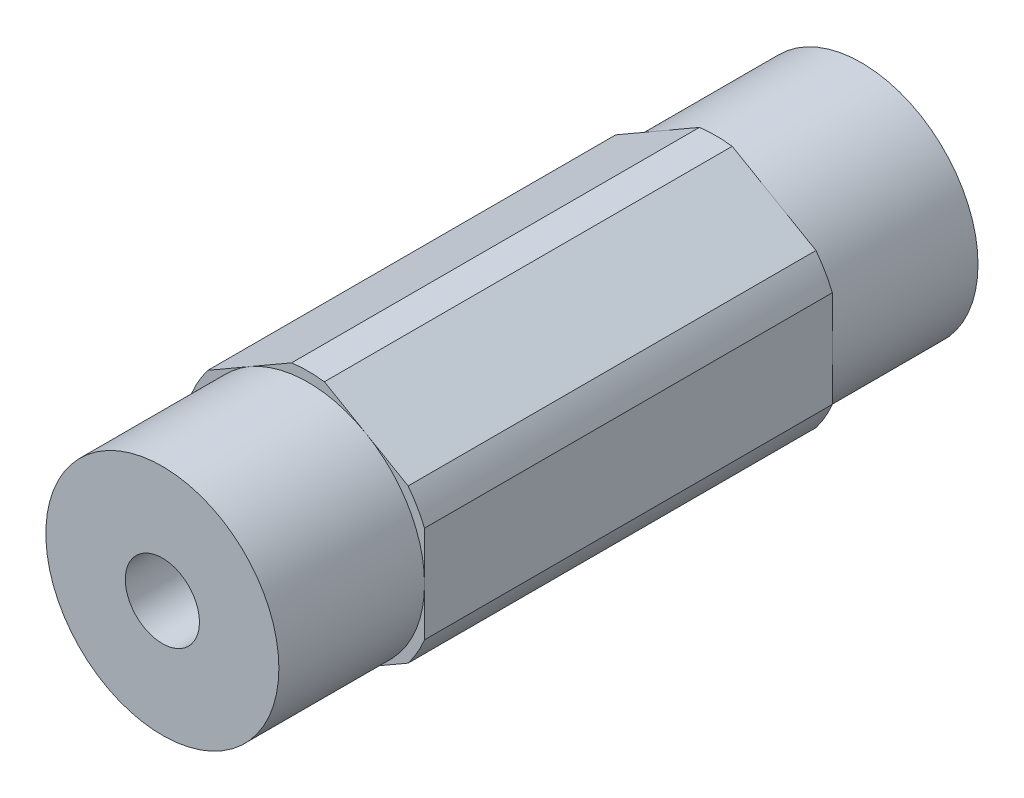
from build123d import *

# Parameters (mm, degrees)
SKETCH1_R                            = 2.0193
BOSS_EXTRUDE1_DEPTH                  = 19.05
F_10_32_TAPPED_HOLE1_D               = 4.0386
F_10_32_TAPPED_HOLE1_DEPTH           = 12.02944
F_10_32_TAPPED_HOLE1_TIP             = 1.213317848
F_10_32_TAPPED_HOLE1_ON_FACE_2_D     = 4.0386
F_10_32_TAPPED_HOLE1_ON_FACE_2_DEPTH = 12.02944
F_10_32_TAPPED_HOLE1_ON_FACE_2_TIP   = 1.213317848
SKETCH5_R                            = 6.874999966
SKETCH5_R_2                          = 6.35
CUT_EXTRUDE1_DEPTH                   = 7.9375


with BuildPart() as part:
    # Sketch1 → Boss-Extrude1 (new, symmetric)
    with BuildSketch(Plane.XY):
        with BuildLine():
            ThreePointArc((0.893039571, 6.816751782), (0, 6.874999966), (-0.893039571, 6.816751782))
            Line((-0.893039571, 6.816751782), (-5.456960429, 4.181770846))
            ThreePointArc((-5.456960429, 4.181770846), (-5.953924622, 3.437499983), (-6.35, 2.634980936))
            Line((-6.35, 2.634980936), (-6.35, -2.634980936))
            ThreePointArc((-6.35, -2.634980936), (-5.953924622, -3.437499983), (-5.456960429, -4.181770846))
            Line((-5.456960429, -4.181770846), (-0.893039571, -6.816751782))
            ThreePointArc((-0.893039571, -6.816751782), (0, -6.874999966), (0.893039571, -6.816751782))
            Line((0.893039571, -6.816751782), (5.456960429, -4.181770846))
            ThreePointArc((5.456960429, -4.181770846), (5.953924622, -3.437499983), (6.35, -2.634980936))
            Line((6.35, -2.634980936), (6.35, 2.634980936))
            ThreePointArc((6.35, 2.634980936), (5.953924622, 3.437499983), (5.456960429, 4.181770846))
            Line((5.456960429, 4.181770846), (0.893039571, 6.816751782))
        make_face()
        with Locations(Location((0, 0, 0), (0, 0, 180))):
            Circle(SKETCH1_R, mode=Mode.SUBTRACT)
    extrude(amount=BOSS_EXTRUDE1_DEPTH, both=True)

    # #10-32 Tapped Hole1
    with Locations(Plane.XY.offset(19.05)):
        with Locations((0, 0)):
            Hole(F_10_32_TAPPED_HOLE1_D / 2, depth=F_10_32_TAPPED_HOLE1_DEPTH)
            with Locations((0, 0, -(F_10_32_TAPPED_HOLE1_DEPTH + F_10_32_TAPPED_HOLE1_TIP / 2))):  # 118° drill point
                Cone(0, F_10_32_TAPPED_HOLE1_D / 2, F_10_32_TAPPED_HOLE1_TIP, mode=Mode.SUBTRACT)

    # #10-32 Tapped Hole1 on face 2
    with Locations(Plane.XY.offset(-19.05)):
        with Locations((0, 0)):
            Hole(F_10_32_TAPPED_HOLE1_ON_FACE_2_D / 2, depth=F_10_32_TAPPED_HOLE1_ON_FACE_2_DEPTH)
            with Locations((0, 0, -(F_10_32_TAPPED_HOLE1_ON_FACE_2_DEPTH + F_10_32_TAPPED_HOLE1_ON_FACE_2_TIP / 2))):  # 118° drill point
                Cone(0, F_10_32_TAPPED_HOLE1_ON_FACE_2_D / 2, F_10_32_TAPPED_HOLE1_ON_FACE_2_TIP, mode=Mode.SUBTRACT)

    # Sketch5 → Cut-Extrude1 (cut)
    with BuildSketch(Plane.XY.offset(19.05)):
        Circle(SKETCH5_R)
        Circle(SKETCH5_R_2, mode=Mode.SUBTRACT)
    cut_extrude1 = extrude(amount=-CUT_EXTRUDE1_DEPTH, mode=Mode.SUBTRACT)

    # Mirror1: Cut-Extrude1 across plane
    add(cut_extrude1.mirror(Plane.XY), mode=Mode.SUBTRACT)


solid = part.part
